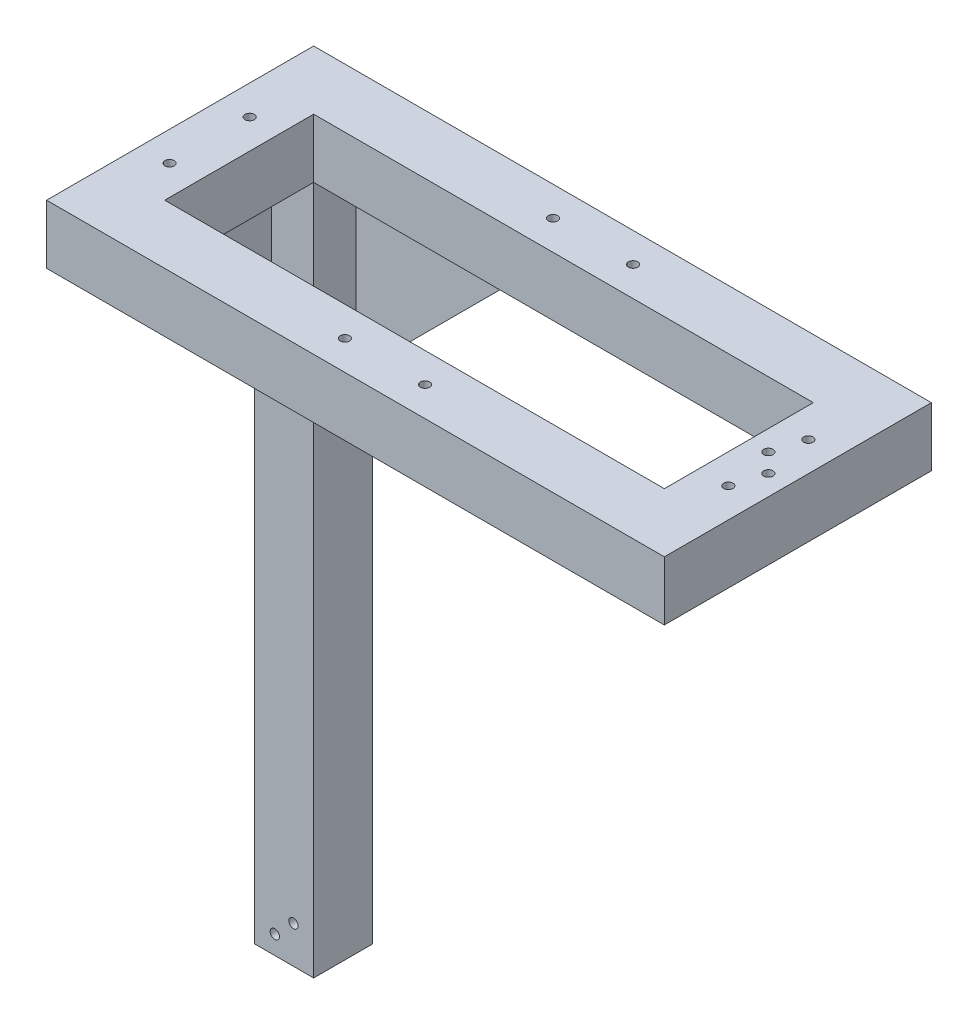
from build123d import *

# Parameters (mm, degrees)
ESBO_O1_W                = 331.7
ESBO_O1_H                = 143.4
RESSALTO_EXTRUS_O2_DEPTH = 31.7
ESBO_O3_W                = 268.3
ESBO_O3_H                = 80
CORTE_EXTRUS_O1_DEPTH    = 31.7
ESBO_O4_R                = 2.5
CORTE_EXTRUS_O2_DEPTH    = 31.7
ESBO_O6_W                = 31.7
ESBO_O6_H                = 31.7
RESSALTO_EXTRUS_O3_DEPTH = 370
ESBO_O7_R                = 2.5
CORTE_EXTRUS_O3_DEPTH    = 412.760989532
RESSALTO_EXTRUS_O4_DEPTH = 4
RESSALTO_EXTRUS_O5_DEPTH = 4


with BuildPart() as part:
    # Esboço1 → Ressalto-extrusão2 (new body)
    with BuildSketch(Plane(origin=(0, 0, 0), x_dir=(1, 0, 0), z_dir=(0, 1, 0))):
        Rectangle(ESBO_O1_W, ESBO_O1_H)
    extrude(amount=RESSALTO_EXTRUS_O2_DEPTH)

    # Esboço3 → Corte-extrusão1 (cut)
    with BuildSketch(Plane(origin=(0, 0, 0), x_dir=(1, 0, 0), z_dir=(0, 1, 0))):
        Rectangle(ESBO_O3_W, ESBO_O3_H)
    extrude(amount=CORTE_EXTRUS_O1_DEPTH, mode=Mode.SUBTRACT)

    # Esboço4 → Corte-extrusão2 (cut)
    with BuildSketch(Plane(origin=(0, 0, 0), x_dir=(1, 0, 0), z_dir=(0, 1, 0))):
        with Locations(Location((21.5, -55.85, 0), (0, 0, 270))):
            Circle(ESBO_O4_R)
        with Locations(Location((-21.5, -55.85, 0), (0, 0, 270))):
            Circle(ESBO_O4_R)
        with Locations(Location((21.5, 55.85, 0), (0, 0, 270))):
            Circle(ESBO_O4_R)
        with Locations(Location((-21.5, 55.85, 0), (0, 0, 270))):
            Circle(ESBO_O4_R)
        with Locations(Location((150, -21.5, 0), (0, 0, 270))):
            Circle(ESBO_O4_R)
        with Locations(Location((150, 21.5, 0), (0, 0, 270))):
            Circle(ESBO_O4_R)
        with Locations(Location((-150, 21.5, 0), (0, 0, 270))):
            Circle(ESBO_O4_R)
        with Locations(Location((-150, -21.5, 0), (0, 0, 270))):
            Circle(ESBO_O4_R)
        with Locations(Location((145, 5, 0), (0, 0, 270))):
            Circle(ESBO_O4_R)
        with Locations(Location((155, -5, 0), (0, 0, 270))):
            Circle(ESBO_O4_R)
    extrude(amount=CORTE_EXTRUS_O2_DEPTH, mode=Mode.SUBTRACT)

    # Esboço6 → Ressalto-extrusão3 (add)
    with BuildSketch(Plane(origin=(0, 0, 0), x_dir=(1, 0, 0), z_dir=(0, 1, 0))):
        with Locations((-150, 55.85)):
            Rectangle(ESBO_O6_W, ESBO_O6_H)
    extrude(amount=-RESSALTO_EXTRUS_O3_DEPTH)

    # Esboço7 → Corte-extrusão3 (cut, through all)
    with BuildSketch(Plane.XY):
        with Locations((-155, -360)):
            Circle(ESBO_O7_R)
        with Locations((-145, -350)):
            Circle(ESBO_O7_R)
    extrude(amount=-CORTE_EXTRUS_O3_DEPTH, mode=Mode.SUBTRACT)


with BuildPart() as body_2:
    # Esboço9 → Ressalto-extrusão4 (new body)
    with BuildSketch(Plane(origin=(-160.85, 0, 0), x_dir=(0, 0, 1), z_dir=(1, 0, 0))):
        Polygon((-40, 0), (60, 0), (-40, 100), align=None)
    extrude(amount=RESSALTO_EXTRUS_O4_DEPTH)


with BuildPart() as body_3:
    # Esboço10 → Ressalto-extrusão5 (new body)
    with BuildSketch(Plane(origin=(0, 0, -66.7), x_dir=(1, 0, 0), z_dir=(0, 0, -1))):
        Polygon((-134.15, 0), (-34.15, 0), (-134.15, 100), align=None)
    extrude(amount=-RESSALTO_EXTRUS_O5_DEPTH)


solid = Compound([part.part, body_2.part, body_3.part])
